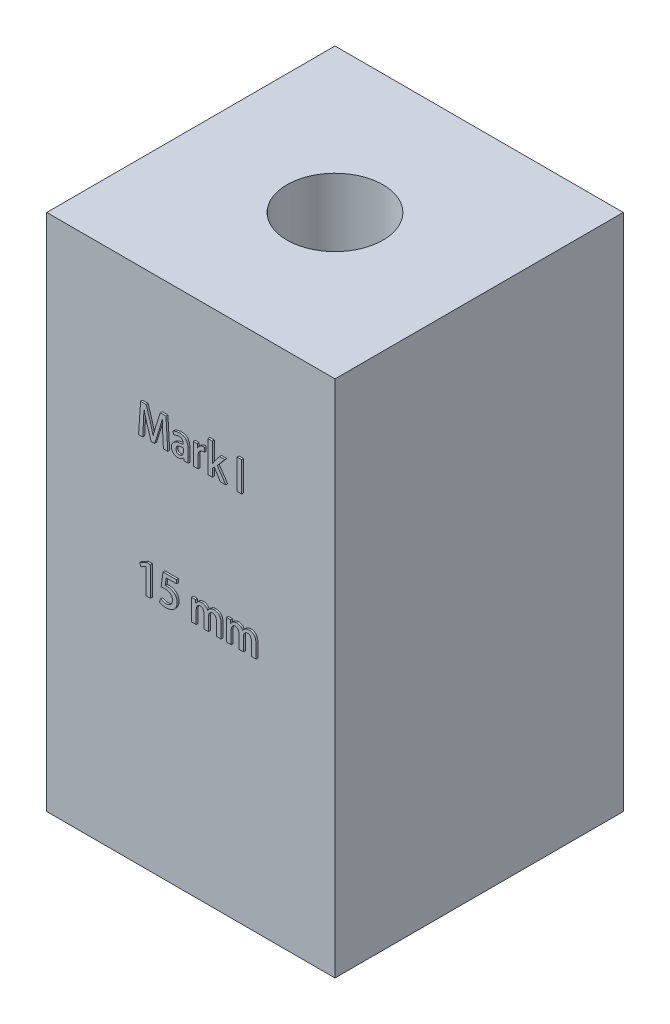
from build123d import *

# Parameters (mm, degrees)
CROQUIS1_W              = 15
CROQUIS1_H              = 15
CROQUIS1_R              = 2.5
SALIENTE_EXTRUIR1_DEPTH = 27
CROQUIS2_2_W            = 0.238171994
CROQUIS2_2_H            = 1.552222223
SALIENTE_EXTRUIR2_DEPTH = 0.1


with BuildPart() as part:
    # Croquis1 → Saliente-Extruir1 (new body)
    with BuildSketch(Plane(origin=(0, 0, 0), x_dir=(1, 0, 0), z_dir=(0, 1, 0))):
        Rectangle(CROQUIS1_W, CROQUIS1_H)
        Circle(CROQUIS1_R, mode=Mode.SUBTRACT)
    extrude(amount=SALIENTE_EXTRUIR1_DEPTH)

    # Croquis2<2> → Saliente-Extruir2 (add)
    # profile 1 of 9: a face of its own
    with BuildSketch(Plane.XY.offset(7.5)):
        with BuildLine():
            Line((-1.196299168, 21.029080524), (-1.489029741, 21.029080524))
            Line((-1.489029741, 21.029080524), (-1.713120041, 20.346907093))
            add(Edge.make_bspline(
                [(-1.713120041, 20.346907093), (-1.727697615, 20.299716085), (-1.756231951, 20.207343783), (-1.795341625, 20.070753521), (-1.829992127, 19.939079232), (-1.850660973, 19.852657221), (-1.860771731, 19.810381416)],
                knots=[0, 0, 0, 0, 1.06482216, 2.08429696, 3.06287894, 4, 4, 4, 4], degree=3))
            Line((-1.860771731, 19.810381416), (-1.866551238, 19.810381416))
            add(Edge.make_bspline(
                [(-1.866551238, 19.810381416), (-1.876481422, 19.853051166), (-1.896683618, 19.939859498), (-1.93070374, 20.071488595), (-1.967459767, 20.207101232), (-1.994351955, 20.298408277), (-2.008015817, 20.344801184)],
                knots=[0, 0, 0, 0, 0.950771496, 1.934271678, 2.950408035, 4, 4, 4, 4], degree=3))
            Line((-2.008015817, 20.344801184), (-2.225903251, 21.029080524))
            Line((-2.225903251, 21.029080524), (-2.516614993, 21.029080524))
            Line((-2.516614993, 21.029080524), (-2.621630897, 19.479409339))
            Line((-2.621630897, 19.479409339), (-2.403560427, 19.479409339))
            Line((-2.403560427, 19.479409339), (-2.36924029, 20.115225551))
            add(Edge.make_bspline(
                [(-2.36924029, 20.115225551), (-2.366142688, 20.170919846), (-2.35989255, 20.283296133), (-2.353809897, 20.423803434), (-2.348367501, 20.535729765), (-2.345730048, 20.61699773), (-2.342790327, 20.695298568), (-2.341738393, 20.746445045), (-2.341221555, 20.771574379)],
                knots=[0, 0, 0, 0, 1.528265809, 3.083634274, 3.853229214, 4.59840858, 5.311368824, 6, 6, 6, 6], degree=3))
            Line((-2.341221555, 20.771574379), (-2.334920154, 20.771597581))
            add(Edge.make_bspline(
                [(-2.334920154, 20.771597581), (-2.324589296, 20.723617077), (-2.303631025, 20.626278754), (-2.266531143, 20.479508668), (-2.225758304, 20.329473172), (-2.195122831, 20.22906041), (-2.179605039, 20.178198314)],
                knots=[0, 0, 0, 0, 0.959753872, 1.947058171, 2.960122984, 4, 4, 4, 4], degree=3))
            Line((-2.179605039, 20.178198314), (-1.967492815, 19.493601312))
            Line((-1.967492815, 19.493601312), (-1.791854471, 19.493601312))
            Line((-1.791854471, 19.493601312), (-1.561707676, 20.192452732))
            add(Edge.make_bspline(
                [(-1.561707676, 20.192452732), (-1.545557325, 20.241909213), (-1.513574545, 20.339848618), (-1.469197981, 20.486028271), (-1.427941936, 20.629553544), (-1.402746733, 20.724599981), (-1.390294614, 20.771574379)],
                knots=[0, 0, 0, 0, 1.033513873, 2.046682856, 3.034620343, 4, 4, 4, 4], degree=3))
            Line((-1.390294614, 20.771574379), (-1.384050501, 20.771597581))
            add(Edge.make_bspline(
                [(-1.384050501, 20.771597581), (-1.384147418, 20.746657815), (-1.384345026, 20.695806648), (-1.383338746, 20.618262138), (-1.381707988, 20.538078238), (-1.377545118, 20.428380993), (-1.371719332, 20.291107159), (-1.366485475, 20.18142271), (-1.363896272, 20.12716152)],
                knots=[0, 0, 0, 0, 0.69615936, 1.419440619, 2.164688967, 2.934803833, 4.483639269, 6, 6, 6, 6], degree=3))
            Line((-1.363896272, 20.12716152), (-1.32954205, 19.479409339))
            Line((-1.32954205, 19.479409339), (-1.103432918, 19.479409339))
            Line((-1.103432918, 19.479409339), (-1.196299168, 21.029080524))
        make_face()
    # profile 2 of 9: a face of its own
    with BuildSketch(Plane.XY.offset(7.5)):
        with BuildLine():
            add(Edge.make_bspline(
                [(-0.053952166, 20.155506797), (-0.053933683, 20.171094279), (-0.053897286, 20.201789221), (-0.057518774, 20.247008773), (-0.063893546, 20.290439821), (-0.073214651, 20.332080632), (-0.085936266, 20.371763587), (-0.101413142, 20.409687835), (-0.120056057, 20.445711117), (-0.141545368, 20.479861857), (-0.167086723, 20.511273005), (-0.197339407, 20.538867014), (-0.232386885, 20.562185402), (-0.272154981, 20.581216365), (-0.316470833, 20.596407), (-0.365308531, 20.607712644), (-0.418720262, 20.615108287), (-0.45586616, 20.61654487), (-0.475152092, 20.617290736)],
                knots=[0, 0, 0, 0, 1.04529413, 2.058397975, 3.039753549, 3.988049356, 4.917306062, 5.832005784, 6.732558164, 7.634995369, 8.534400609, 9.439717093, 10.371077683, 11.347885902, 12.389132223, 13.507522911, 14.705920534, 16, 16, 16, 16], degree=3))
            add(Edge.make_bspline(
                [(-0.475152092, 20.617290736), (-0.492957595, 20.616816764), (-0.528048962, 20.615882654), (-0.579600467, 20.61088989), (-0.629120436, 20.602765232), (-0.676037595, 20.591206125), (-0.720086934, 20.577835591), (-0.760725874, 20.56297161), (-0.797576215, 20.546416367), (-0.820085609, 20.533481991), (-0.830943079, 20.527243058)],
                knots=[0, 0, 0, 0, 1.151566781, 2.269526023, 3.346377101, 4.393757963, 5.391790339, 6.321988655, 7.190606464, 8, 8, 8, 8], degree=3))
            Line((-0.830943079, 20.527243058), (-0.781123083, 20.369063254))
            add(Edge.make_bspline(
                [(-0.781123083, 20.369063254), (-0.77171247, 20.37510656), (-0.75272953, 20.387297021), (-0.722239537, 20.403059962), (-0.690103274, 20.417263833), (-0.656139477, 20.428702506), (-0.621351216, 20.438541683), (-0.585956767, 20.445552861), (-0.550147937, 20.449783122), (-0.526200151, 20.450385225), (-0.514162975, 20.450687867)],
                knots=[0, 0, 0, 0, 0.947728913, 1.911743672, 2.906591377, 3.923705885, 4.947352295, 5.969890554, 6.979580645, 8, 8, 8, 8], degree=3))
            add(Edge.make_bspline(
                [(-0.514162975, 20.450687867), (-0.501813894, 20.449873349), (-0.478242904, 20.448318659), (-0.444972946, 20.442010936), (-0.415449317, 20.43362517), (-0.389446639, 20.42296027), (-0.367418177, 20.408938358), (-0.348994114, 20.39252782), (-0.334418974, 20.373321038), (-0.321472296, 20.344609444), (-0.310378364, 20.308152502), (-0.300596189, 20.265632707), (-0.296081909, 20.224913524), (-0.297364519, 20.198636491), (-0.297989886, 20.185824502)],
                knots=[0, 0, 0, 0, 1.124941475, 2.147203117, 3.073276344, 3.914150165, 4.693859246, 5.436944029, 6.148486199, 6.868538222, 8.288979618, 9.609682438, 10.834544209, 12, 12, 12, 12], degree=3))
            add(Edge.make_bspline(
                [(-0.297989886, 20.185824502), (-0.320678653, 20.185539999), (-0.365025123, 20.184983922), (-0.429782822, 20.180745531), (-0.490876774, 20.172779945), (-0.548357177, 20.161890924), (-0.60242818, 20.148446821), (-0.652727709, 20.130932907), (-0.699627981, 20.11078697), (-0.742785665, 20.087455124), (-0.78181461, 20.060849193), (-0.815831886, 20.03054531), (-0.844514985, 19.996643678), (-0.868702711, 19.959781778), (-0.887106432, 19.919009882), (-0.900985991, 19.875142448), (-0.90956491, 19.827714103), (-0.911105263, 19.794968866), (-0.911897994, 19.778116776)],
                knots=[0, 0, 0, 0, 1.312583045, 2.565517338, 3.751913568, 4.874585872, 5.948775456, 6.97196923, 7.952367169, 8.899011352, 9.80588498, 10.679130641, 11.525793372, 12.368308044, 13.221239438, 14.104974037, 15.024739096, 16, 16, 16, 16], degree=3))
            add(Edge.make_bspline(
                [(-0.911897994, 19.778116776), (-0.911473645, 19.767156476), (-0.910641021, 19.745651047), (-0.906633242, 19.713979761), (-0.899372869, 19.68374055), (-0.890222197, 19.654513549), (-0.877670348, 19.62680416), (-0.862708273, 19.600423672), (-0.845267409, 19.575176501), (-0.825103672, 19.551624148), (-0.802677089, 19.5297669), (-0.777493306, 19.511004679), (-0.750365313, 19.494799783), (-0.721140808, 19.481133874), (-0.689496917, 19.470690929), (-0.655746236, 19.462757034), (-0.61969828, 19.457773568), (-0.594937614, 19.456639732), (-0.582212035, 19.456057004)],
                knots=[0, 0, 0, 0, 1.019558823, 2.000497171, 2.961865832, 3.90763667, 4.843526869, 5.78386522, 6.724423229, 7.691661655, 8.662438953, 9.629634663, 10.603980382, 11.596308817, 12.622532153, 13.696327026, 14.81604254, 16, 16, 16, 16], degree=3))
            add(Edge.make_bspline(
                [(-0.582212035, 19.456057004), (-0.565841961, 19.456612545), (-0.533867175, 19.457697653), (-0.487707844, 19.466370755), (-0.444274735, 19.478668363), (-0.404395551, 19.496746116), (-0.368185088, 19.518848134), (-0.335215096, 19.543532898), (-0.306123182, 19.571455519), (-0.289918348, 19.592526447), (-0.281857566, 19.603007774)],
                knots=[0, 0, 0, 0, 1.130657597, 2.208452709, 3.237069398, 4.244418774, 5.223812689, 6.164576675, 7.087004055, 8, 8, 8, 8], degree=3))
            Line((-0.281857566, 19.603007774), (-0.275253111, 19.603065349))
            Line((-0.275253111, 19.603065349), (-0.258392086, 19.477618228))
            Line((-0.258392086, 19.477618228), (-0.037732768, 19.477618228))
            add(Edge.make_bspline(
                [(-0.037732768, 19.477618228), (-0.040897849, 19.496597162), (-0.047581659, 19.536675639), (-0.051747532, 19.600214154), (-0.05403103, 19.668395576), (-0.054172931, 19.715246615), (-0.054245195, 19.739105893)],
                knots=[0, 0, 0, 0, 0.879539962, 1.857355241, 2.908840502, 4, 4, 4, 4], degree=3))
            Line((-0.054245195, 19.739105893), (-0.053952166, 20.155506797))
        make_face()
        with BuildLine():
            add(Edge.make_bspline(
                [(-0.292123874, 19.85181673), (-0.292565708, 19.843563522), (-0.293425459, 19.827503836), (-0.297118337, 19.804055524), (-0.302157272, 19.781770952), (-0.30974875, 19.760760078), (-0.318698035, 19.74068664), (-0.329992125, 19.721921664), (-0.342912234, 19.704123049), (-0.357899957, 19.687847624), (-0.374138828, 19.672946445), (-0.391614279, 19.660011148), (-0.409781112, 19.64873434), (-0.42910308, 19.639619265), (-0.449388406, 19.632186668), (-0.470747733, 19.627011652), (-0.493045123, 19.623714024), (-0.508187646, 19.623016293), (-0.515922865, 19.622659873)],
                knots=[0, 0, 0, 0, 1.1127689, 2.165305488, 3.194083487, 4.185588777, 5.169981375, 6.15040018, 7.13046498, 8.12816315, 9.12586132, 10.095335325, 11.053196287, 12.001774197, 12.968470205, 13.958837393, 14.957317833, 16, 16, 16, 16], degree=3))
            add(Edge.make_bspline(
                [(-0.515922865, 19.622659873), (-0.526348867, 19.622986841), (-0.54677129, 19.623627305), (-0.576043385, 19.632361798), (-0.60296697, 19.646059855), (-0.627344866, 19.665200397), (-0.647756744, 19.69069521), (-0.66238159, 19.722675436), (-0.671428419, 19.760622731), (-0.672737046, 19.787936502), (-0.673432972, 19.802461914)],
                knots=[0, 0, 0, 0, 0.925162071, 1.812204857, 2.691873356, 3.602553412, 4.549923018, 5.56994314, 6.707700436, 8, 8, 8, 8], degree=3))
            add(Edge.make_bspline(
                [(-0.673432972, 19.802461914), (-0.672504166, 19.814124606), (-0.670710258, 19.836650073), (-0.664133484, 19.868903199), (-0.653394707, 19.897940713), (-0.639623735, 19.923993766), (-0.622452724, 19.947140376), (-0.60120143, 19.966485377), (-0.576944474, 19.983265842), (-0.53961783, 20.000360001), (-0.489300298, 20.016507544), (-0.426242327, 20.030369907), (-0.360162716, 20.037877182), (-0.315313119, 20.037760195), (-0.292416903, 20.037700472)],
                knots=[0, 0, 0, 0, 0.831751151, 1.606454387, 2.332498033, 3.02628555, 3.696675427, 4.370806108, 5.061344671, 5.786088267, 7.281491765, 8.811961156, 10.372470837, 12, 12, 12, 12], degree=3))
            Line((-0.292416903, 20.037700472), (-0.292123874, 19.85181673))
        make_face(mode=Mode.SUBTRACT)
    # profile 3 of 9: a face of its own
    with BuildSketch(Plane.XY.offset(7.5)):
        with BuildLine():
            add(Edge.make_bspline(
                [(0.798083824, 20.611553336), (0.788539911, 20.613210649), (0.769047446, 20.61659554), (0.749267113, 20.617055819), (0.739171639, 20.617290736)],
                knots=[0, 0, 0, 0, 0.97924127, 2, 2, 2, 2], degree=3))
            add(Edge.make_bspline(
                [(0.739171639, 20.617290736), (0.723847826, 20.616453707), (0.693455305, 20.614793584), (0.648964014, 20.602845287), (0.606665471, 20.583392189), (0.566554279, 20.557213359), (0.529366688, 20.524773207), (0.497456952, 20.485421616), (0.469512451, 20.440761818), (0.456024619, 20.407616391), (0.449083192, 20.39055831)],
                knots=[0, 0, 0, 0, 0.938175605, 1.860732817, 2.801619752, 3.780189859, 4.786007179, 5.811395864, 6.873648904, 8, 8, 8, 8], degree=3))
            Line((0.449083192, 20.39055831), (0.440870375, 20.390609296))
            Line((0.440870375, 20.390609296), (0.432657557, 20.593479237))
            Line((0.432657557, 20.593479237), (0.225386747, 20.593479237))
            add(Edge.make_bspline(
                [(0.225386747, 20.593479237), (0.226735788, 20.567494093), (0.229489608, 20.514450168), (0.231570538, 20.432608946), (0.233218682, 20.345688049), (0.233208637, 20.28584588), (0.233203418, 20.254753506)],
                knots=[0, 0, 0, 0, 0.921405029, 1.880880017, 2.898962507, 4, 4, 4, 4], degree=3))
            Line((0.233203418, 20.254753506), (0.233496446, 19.478268161))
            Line((0.233496446, 19.478268161), (0.47166844, 19.478268161))
            Line((0.47166844, 19.478268161), (0.47166844, 20.070276186))
            add(Edge.make_bspline(
                [(0.47166844, 20.070276186), (0.472033638, 20.082301823), (0.47274468, 20.105715785), (0.475848675, 20.139945871), (0.481442585, 20.172189381), (0.489050183, 20.202603479), (0.498765514, 20.231145838), (0.510353047, 20.258001793), (0.524589729, 20.282599339), (0.540410607, 20.305428882), (0.558265096, 20.325823855), (0.577615533, 20.344024212), (0.599106245, 20.358987052), (0.621896445, 20.371773551), (0.646567142, 20.381305855), (0.672514788, 20.388861822), (0.700215782, 20.393190292), (0.719212277, 20.393972346), (0.728905617, 20.394371404)],
                knots=[0, 0, 0, 0, 1.241840886, 2.417868999, 3.544527356, 4.616704577, 5.650820151, 6.654086497, 7.630544836, 8.5797601, 9.516878827, 10.423948895, 11.314471818, 12.213419717, 13.114913654, 14.038234368, 14.998969914, 16, 16, 16, 16], degree=3))
            add(Edge.make_bspline(
                [(0.728905617, 20.394371404), (0.741154195, 20.394190832), (0.764272582, 20.393850016), (0.787101102, 20.390214468), (0.797834621, 20.388505106)],
                knots=[0, 0, 0, 0, 1.059639438, 2, 2, 2, 2], degree=3))
            Line((0.797834621, 20.388505106), (0.798083824, 20.611553336))
        make_face()
    # profile 4 of 9: a face of its own
    with BuildSketch(Plane.XY.offset(7.5)):
        with BuildLine():
            Line((1.473955281, 20.134031505), (1.867275682, 20.594647054))
            Line((1.867275682, 20.594647054), (1.589518491, 20.594647054))
            Line((1.589518491, 20.594647054), (1.311761301, 20.221284671))
            add(Edge.make_bspline(
                [(1.311761301, 20.221284671), (1.297091766, 20.200201073), (1.267485244, 20.157649487), (1.240155846, 20.113600536), (1.226367706, 20.091377101)],
                knots=[0, 0, 0, 0, 0.99096644, 2, 2, 2, 2], degree=3))
            Line((1.226367706, 20.091377101), (1.222554612, 20.091419494))
            Line((1.222554612, 20.091419494), (1.222554612, 21.103899887))
            Line((1.222554612, 21.103899887), (0.984382618, 21.103899887))
            Line((0.984382618, 21.103899887), (0.984382618, 19.476589047))
            Line((0.984382618, 19.476589047), (1.222554612, 19.476589047))
            Line((1.222554612, 19.476589047), (1.222554612, 19.878359438))
            Line((1.222554612, 19.878359438), (1.313788726, 19.989962325))
            Line((1.313788726, 19.989962325), (1.634121836, 19.476589047))
            Line((1.634121836, 19.476589047), (1.9179613, 19.476589047))
            Line((1.9179613, 19.476589047), (1.473955281, 20.134031505))
        make_face()
    # profile 5 of 9: a face of its own
    with BuildSketch(Plane.XY.offset(7.5)):
        with Locations((2.624013114, 20.252700159)):
            Rectangle(CROQUIS2_2_W, CROQUIS2_2_H)
    # profile 6 of 9: a face of its own
    with BuildSketch(Plane.XY.offset(7.5)):
        Polygon((-2.006255927, 12.406347497), (-2.006255927, 13.92454519), (-2.212803475, 13.92454519), (-2.558678757, 13.749288098), (-2.505965713, 13.578477993), (-2.248482771, 13.720397725), (-2.244427921, 13.720397725), (-2.244427921, 12.408653915), align=None)
    # profile 7 of 9: a face of its own
    with BuildSketch(Plane.XY.offset(7.5)):
        with BuildLine():
            Line((-1.350512347, 13.924105217), (-1.44580131, 13.20128046))
            add(Edge.make_bspline(
                [(-1.44580131, 13.20128046), (-1.43298494, 13.203147672), (-1.405695444, 13.20712347), (-1.362099157, 13.21075672), (-1.313463585, 13.21265508), (-1.279423347, 13.213049488), (-1.261529368, 13.213256817)],
                knots=[0, 0, 0, 0, 0.840675257, 1.790023498, 2.838278579, 4, 4, 4, 4], degree=3))
            add(Edge.make_bspline(
                [(-1.261529368, 13.213256817), (-1.245097713, 13.21283534), (-1.213259176, 13.212018673), (-1.16705693, 13.208125916), (-1.124104076, 13.200873708), (-1.084108271, 13.191919652), (-1.047556468, 13.179267997), (-1.013846245, 13.164982757), (-0.9837878, 13.147029866), (-0.956592106, 13.127173619), (-0.932738292, 13.104740922), (-0.91202921, 13.080260266), (-0.894571806, 13.053673619), (-0.880494434, 13.024941725), (-0.869232078, 12.994301358), (-0.861433211, 12.961618437), (-0.856576099, 12.926932733), (-0.856113047, 12.903142022), (-0.855874846, 12.89090373)],
                knots=[0, 0, 0, 0, 1.341376774, 2.59909746, 3.779710086, 4.894529723, 5.939178048, 6.932464489, 7.876722667, 8.789576717, 9.675853731, 10.542223295, 11.400915923, 12.264488366, 13.147995251, 14.059523137, 15.001790096, 16, 16, 16, 16], degree=3))
            add(Edge.make_bspline(
                [(-0.855874846, 12.89090373), (-0.856548815, 12.878662862), (-0.857864707, 12.854763128), (-0.863250285, 12.820031096), (-0.871046155, 12.787271137), (-0.881871196, 12.756645866), (-0.895763471, 12.728208392), (-0.912612399, 12.702022857), (-0.931986345, 12.677842007), (-0.954089594, 12.656046668), (-0.978406121, 12.637066697), (-1.003673338, 12.619719854), (-1.030463122, 12.605373146), (-1.058501293, 12.593659531), (-1.087689017, 12.584107688), (-1.118159443, 12.577506237), (-1.149851103, 12.573215351), (-1.171369689, 12.572651197), (-1.182334342, 12.572363737)],
                knots=[0, 0, 0, 0, 1.152868708, 2.250923491, 3.301801517, 4.317254504, 5.300529871, 6.272770222, 7.241085836, 8.210318644, 9.185817546, 10.140047819, 11.09081316, 12.039038429, 12.996146563, 13.975973343, 14.968670553, 16, 16, 16, 16], degree=3))
            add(Edge.make_bspline(
                [(-1.182334342, 12.572363737), (-1.19770527, 12.57277607), (-1.22775537, 12.57358218), (-1.271670161, 12.579364921), (-1.313775575, 12.586492304), (-1.353263448, 12.59764633), (-1.389787296, 12.609822368), (-1.422902199, 12.622459695), (-1.452209263, 12.635369757), (-1.469941843, 12.645180615), (-1.478289087, 12.649798873)],
                knots=[0, 0, 0, 0, 1.193399157, 2.333090457, 3.436795921, 4.50708013, 5.515645667, 6.426671089, 7.259387983, 8, 8, 8, 8], degree=3))
            Line((-1.478289087, 12.649798873), (-1.53095315, 12.47224052))
            add(Edge.make_bspline(
                [(-1.53095315, 12.47224052), (-1.521128296, 12.466500875), (-1.500408129, 12.454396227), (-1.465390911, 12.439466883), (-1.425703754, 12.42542339), (-1.381549105, 12.412733086), (-1.33374426, 12.401715492), (-1.282811559, 12.394428257), (-1.229466621, 12.389213062), (-1.193004546, 12.388322632), (-1.17441484, 12.387868658)],
                knots=[0, 0, 0, 0, 0.736688515, 1.55364239, 2.461382292, 3.463906092, 4.529034637, 5.637376459, 6.795447667, 8, 8, 8, 8], degree=3))
            add(Edge.make_bspline(
                [(-1.17441484, 12.387868658), (-1.153855568, 12.388702437), (-1.113570597, 12.39033619), (-1.054938297, 12.398468483), (-0.999302556, 12.410296592), (-0.947030924, 12.427009359), (-0.897932776, 12.448291429), (-0.852106272, 12.473787805), (-0.809395189, 12.503706071), (-0.770285307, 12.537857442), (-0.735272128, 12.575717244), (-0.704112777, 12.615977268), (-0.678031428, 12.659096375), (-0.656070631, 12.704481679), (-0.63903494, 12.752592524), (-0.626789725, 12.80321266), (-0.619035705, 12.856356115), (-0.617570503, 12.892637556), (-0.616823194, 12.911142459)],
                knots=[0, 0, 0, 0, 1.153861066, 2.260939018, 3.31647699, 4.341761202, 5.334341534, 6.314182747, 7.279045245, 8.254885833, 9.221368745, 10.168239568, 11.10621774, 12.043473791, 12.992550795, 13.963801276, 14.961461872, 16, 16, 16, 16], degree=3))
            add(Edge.make_bspline(
                [(-0.616823194, 12.911142459), (-0.617752851, 12.930140733), (-0.619562946, 12.967131471), (-0.627877719, 13.020653409), (-0.640348932, 13.070527486), (-0.65748124, 13.116647711), (-0.678801889, 13.159286688), (-0.705283934, 13.197837718), (-0.735551204, 13.233231487), (-0.770648936, 13.264092192), (-0.808840834, 13.29117334), (-0.849066366, 13.315141407), (-0.891501089, 13.334995459), (-0.935884299, 13.351652729), (-0.982421066, 13.364456427), (-1.031079968, 13.373551056), (-1.081705119, 13.378875482), (-1.116130254, 13.379527813), (-1.133644067, 13.379859686)],
                knots=[0, 0, 0, 0, 1.161144111, 2.26081465, 3.302219781, 4.296139684, 5.260280275, 6.206065629, 7.14595017, 8.097655962, 9.052205465, 10.002655077, 10.953667363, 11.909840711, 12.895057104, 13.897658319, 14.930432064, 16, 16, 16, 16], degree=3))
            add(Edge.make_bspline(
                [(-1.133644067, 13.379859686), (-1.143226953, 13.379598011), (-1.16161501, 13.379095897), (-1.188109942, 13.377867911), (-1.212384324, 13.37658348), (-1.227802542, 13.375026674), (-1.235131026, 13.374286703)],
                knots=[0, 0, 0, 0, 1.131480046, 2.171133133, 3.130715184, 4, 4, 4, 4], degree=3))
            Line((-1.235131026, 13.374286703), (-1.184263518, 13.739609565))
            Line((-1.184263518, 13.739609565), (-0.649023385, 13.739609565))
            Line((-0.649023385, 13.739609565), (-0.649023385, 13.924105217))
            Line((-0.649023385, 13.924105217), (-1.350512347, 13.924105217))
        make_face()
    # profile 8 of 9: a face of its own
    with BuildSketch(Plane.XY.offset(7.5)):
        with BuildLine():
            add(Edge.make_bspline(
                [(1.673086029, 13.090464425), (1.67215772, 13.111077003), (1.670365963, 13.150861952), (1.663815589, 13.208116919), (1.654840245, 13.260791645), (1.641836074, 13.308435454), (1.626213175, 13.351330131), (1.607054541, 13.389270084), (1.584725268, 13.42252538), (1.55905493, 13.450782133), (1.531172757, 13.474285603), (1.502990684, 13.495127157), (1.473861975, 13.512414251), (1.444116532, 13.526724485), (1.413415931, 13.53741003), (1.381877872, 13.544208935), (1.34978937, 13.548726162), (1.328163308, 13.548586131), (1.317295329, 13.54851576)],
                knots=[0, 0, 0, 0, 1.513261231, 2.920790482, 4.225039661, 5.429095985, 6.538902965, 7.568588871, 8.539409605, 9.468669045, 10.358677973, 11.210859535, 12.037483604, 12.839564471, 13.628941055, 14.4154775, 15.203712731, 16, 16, 16, 16], degree=3))
            add(Edge.make_bspline(
                [(1.317295329, 13.54851576), (1.298079599, 13.547757116), (1.260829637, 13.546286475), (1.207305651, 13.535705198), (1.157840201, 13.519457225), (1.112968522, 13.495943442), (1.072406348, 13.466676206), (1.034744112, 13.433531571), (1.00106113, 13.395010462), (0.981834694, 13.366489389), (0.972063678, 13.35199477)],
                knots=[0, 0, 0, 0, 1.108126197, 2.148118191, 3.136426768, 4.10280475, 5.057637098, 6.016626622, 6.992035069, 8, 8, 8, 8], degree=3))
            Line((0.972063678, 13.35199477), (0.968006824, 13.352002217))
            add(Edge.make_bspline(
                [(0.968006824, 13.352002217), (0.961392471, 13.366707133), (0.948448558, 13.39548382), (0.921685547, 13.434177719), (0.890103124, 13.46783246), (0.853781486, 13.49650351), (0.813254282, 13.519473905), (0.768881432, 13.535897487), (0.721292811, 13.546591562), (0.688291365, 13.547864722), (0.671415895, 13.54851576)],
                knots=[0, 0, 0, 0, 1.020955632, 1.99795227, 2.96752067, 3.938931661, 4.92195175, 5.909051468, 6.930781959, 8, 8, 8, 8], degree=3))
            add(Edge.make_bspline(
                [(0.671415895, 13.54851576), (0.6521002, 13.547449292), (0.61511286, 13.545407129), (0.562388939, 13.534511912), (0.515249124, 13.517070985), (0.474221835, 13.492789433), (0.438592589, 13.464778075), (0.407276231, 13.434690478), (0.380074943, 13.402786337), (0.365787507, 13.379377136), (0.3587422, 13.367833775)],
                knots=[0, 0, 0, 0, 1.224631561, 2.345029053, 3.39800305, 4.394808606, 5.352867572, 6.264332918, 7.144121535, 8, 8, 8, 8], degree=3))
            Line((0.3587422, 13.367833775), (0.352736119, 13.368050897))
            Line((0.352736119, 13.368050897), (0.340200343, 13.525358204))
            Line((0.340200343, 13.525358204), (0.131525976, 13.525358204))
            add(Edge.make_bspline(
                [(0.131525976, 13.525358204), (0.132493307, 13.502377927), (0.134468753, 13.455448483), (0.136595679, 13.39589831), (0.138368214, 13.345843903), (0.138685915, 13.305454338), (0.139522755, 13.262536495), (0.139403866, 13.233104947), (0.139342646, 13.217949856)],
                knots=[0, 0, 0, 0, 1.346187736, 2.749133221, 3.487683855, 4.277464658, 5.113020504, 6, 6, 6, 6], degree=3))
            Line((0.139342646, 13.217949856), (0.139635675, 12.415331985))
            Line((0.139635675, 12.415331985), (0.377807669, 12.415331985))
            Line((0.377807669, 12.415331985), (0.377807669, 13.09249185))
            add(Edge.make_bspline(
                [(0.377807669, 13.09249185), (0.378348178, 13.103232166), (0.379399057, 13.124113934), (0.383309839, 13.154351077), (0.388603781, 13.182714145), (0.396741567, 13.208921168), (0.4063118, 13.233312822), (0.417749669, 13.255813951), (0.431292194, 13.276229203), (0.446897459, 13.294305112), (0.463581554, 13.3102841), (0.480601331, 13.324459513), (0.498012247, 13.336630126), (0.515924601, 13.346708092), (0.534444651, 13.354404904), (0.553412463, 13.359518265), (0.572608886, 13.363404703), (0.585650228, 13.363814309), (0.592220869, 13.364020681)],
                knots=[0, 0, 0, 0, 1.345028047, 2.615059288, 3.812240957, 4.950008049, 6.042686379, 7.08768926, 8.102172383, 9.099996684, 10.068982838, 10.989984122, 11.868914175, 12.723236376, 13.556990843, 14.370301474, 15.178906315, 16, 16, 16, 16], degree=3))
            add(Edge.make_bspline(
                [(0.592220869, 13.364020681), (0.600061394, 13.363617765), (0.615262384, 13.362836603), (0.637138995, 13.358672907), (0.657348023, 13.35218983), (0.676014706, 13.343336594), (0.693028444, 13.332125134), (0.70865157, 13.318820156), (0.722008049, 13.302722765), (0.73839249, 13.2784282), (0.754230828, 13.243127456), (0.768611103, 13.196390913), (0.776167652, 13.143983411), (0.777106302, 13.107390927), (0.777595893, 13.088304665)],
                knots=[0, 0, 0, 0, 0.755950668, 1.465615932, 2.139074498, 2.796588983, 3.449971736, 4.097964407, 4.76639413, 5.458962618, 6.917416126, 8.473425038, 10.160574856, 12, 12, 12, 12], degree=3))
            Line((0.777595893, 13.088304665), (0.777888921, 12.415331985))
            Line((0.777888921, 12.415331985), (1.016060629, 12.415331985))
            Line((1.016060629, 12.415331985), (1.016060629, 13.104656398))
            add(Edge.make_bspline(
                [(1.016060629, 13.104656398), (1.016353399, 13.114571964), (1.016923084, 13.133866112), (1.021025984, 13.161890797), (1.026417888, 13.188429555), (1.034052204, 13.213245523), (1.043384886, 13.236423752), (1.055028985, 13.257615396), (1.06812976, 13.277456637), (1.08339485, 13.295181398), (1.099920174, 13.311035697), (1.117023788, 13.325066276), (1.13481524, 13.336940192), (1.153152668, 13.346742493), (1.172119183, 13.354409104), (1.191853198, 13.359596926), (1.211950274, 13.363375547), (1.225665744, 13.363805556), (1.232527319, 13.364020681)],
                knots=[0, 0, 0, 0, 1.267233675, 2.465839704, 3.615673463, 4.726804397, 5.780700789, 6.804285049, 7.813184962, 8.815168933, 9.787633234, 10.738404153, 11.639821434, 12.517791614, 13.392909498, 14.248069017, 15.123543946, 16, 16, 16, 16], degree=3))
            add(Edge.make_bspline(
                [(1.232527319, 13.364020681), (1.24104506, 13.363598871), (1.257591622, 13.362779462), (1.281637079, 13.358845879), (1.303617687, 13.351507281), (1.324280038, 13.342725949), (1.342511559, 13.330226053), (1.359492705, 13.315984048), (1.374201521, 13.298535998), (1.387325849, 13.278934345), (1.398746755, 13.257167011), (1.408343734, 13.233402408), (1.416920116, 13.207997405), (1.423645135, 13.180618265), (1.428409127, 13.151460102), (1.4324143, 13.120568649), (1.434335708, 13.087743085), (1.434524513, 13.065232341), (1.434621293, 13.053693505)],
                knots=[0, 0, 0, 0, 0.979325905, 1.902438322, 2.786756391, 3.636233264, 4.470958944, 5.315074409, 6.175027208, 7.081388835, 8.020752095, 8.99258041, 10.022434341, 11.098284182, 12.226320848, 13.414468146, 14.674676153, 16, 16, 16, 16], degree=3))
            Line((1.434621293, 13.053693505), (1.434914035, 12.415331985))
            Line((1.434914035, 12.415331985), (1.673086029, 12.415331985))
            Line((1.673086029, 12.415331985), (1.673086029, 13.090464425))
        make_face()
    # profile 9 of 9: a face of its own
    with BuildSketch(Plane.XY.offset(7.5)):
        with BuildLine():
            add(Edge.make_bspline(
                [(3.493984996, 13.090464425), (3.493056687, 13.111077003), (3.49126493, 13.150861952), (3.484714556, 13.208116919), (3.475739212, 13.260791645), (3.462735041, 13.308435454), (3.447112142, 13.351330131), (3.427953508, 13.389270084), (3.405624235, 13.42252538), (3.379953897, 13.450782133), (3.352071724, 13.474285603), (3.323889651, 13.495127157), (3.294760942, 13.512414251), (3.2650155, 13.526724485), (3.234314898, 13.53741003), (3.202776839, 13.544208935), (3.170688337, 13.548726162), (3.149062275, 13.548586131), (3.138194296, 13.54851576)],
                knots=[0, 0, 0, 0, 1.513261231, 2.920790482, 4.225039661, 5.429095985, 6.538902965, 7.568588871, 8.539409605, 9.468669045, 10.358677973, 11.210859535, 12.037483604, 12.839564471, 13.628941055, 14.4154775, 15.203712731, 16, 16, 16, 16], degree=3))
            add(Edge.make_bspline(
                [(3.138194296, 13.54851576), (3.118978566, 13.547757116), (3.081728604, 13.546286475), (3.028204618, 13.535705198), (2.978739168, 13.519457225), (2.933867489, 13.495943442), (2.893305315, 13.466676206), (2.855643079, 13.433531571), (2.821960097, 13.395010462), (2.802733661, 13.366489389), (2.792962646, 13.35199477)],
                knots=[0, 0, 0, 0, 1.108126197, 2.148118191, 3.136426768, 4.10280475, 5.057637098, 6.016626622, 6.992035069, 8, 8, 8, 8], degree=3))
            Line((2.792962646, 13.35199477), (2.788905791, 13.352002217))
            add(Edge.make_bspline(
                [(2.788905791, 13.352002217), (2.782291438, 13.366707133), (2.769347526, 13.39548382), (2.742584514, 13.434177719), (2.711002091, 13.46783246), (2.674680453, 13.49650351), (2.634153249, 13.519473905), (2.589780399, 13.535897487), (2.542191778, 13.546591562), (2.509190332, 13.547864722), (2.492314862, 13.54851576)],
                knots=[0, 0, 0, 0, 1.020955632, 1.99795227, 2.96752067, 3.938931661, 4.92195175, 5.909051468, 6.930781959, 8, 8, 8, 8], degree=3))
            add(Edge.make_bspline(
                [(2.492314862, 13.54851576), (2.472999167, 13.547449292), (2.436011827, 13.545407129), (2.383287906, 13.534511912), (2.336148092, 13.517070985), (2.295120802, 13.492789433), (2.259491556, 13.464778075), (2.228175198, 13.434690478), (2.20097391, 13.402786337), (2.186686475, 13.379377136), (2.179641167, 13.367833775)],
                knots=[0, 0, 0, 0, 1.224631561, 2.345029053, 3.39800305, 4.394808606, 5.352867572, 6.264332918, 7.144121535, 8, 8, 8, 8], degree=3))
            Line((2.179641167, 13.367833775), (2.173635086, 13.368050897))
            Line((2.173635086, 13.368050897), (2.161099311, 13.525358204))
            Line((2.161099311, 13.525358204), (1.952424943, 13.525358204))
            add(Edge.make_bspline(
                [(1.952424943, 13.525358204), (1.953392274, 13.502377927), (1.95536772, 13.455448483), (1.957494646, 13.39589831), (1.959267181, 13.345843903), (1.959584882, 13.305454338), (1.960421722, 13.262536495), (1.960302833, 13.233104947), (1.960241613, 13.217949856)],
                knots=[0, 0, 0, 0, 1.346187736, 2.749133221, 3.487683855, 4.277464658, 5.113020504, 6, 6, 6, 6], degree=3))
            Line((1.960241613, 13.217949856), (1.960534642, 12.415331985))
            Line((1.960534642, 12.415331985), (2.198706636, 12.415331985))
            Line((2.198706636, 12.415331985), (2.198706636, 13.09249185))
            add(Edge.make_bspline(
                [(2.198706636, 13.09249185), (2.199247145, 13.103232166), (2.200298025, 13.124113934), (2.204208806, 13.154351077), (2.209502748, 13.182714145), (2.217640534, 13.208921168), (2.227210767, 13.233312822), (2.238648636, 13.255813951), (2.252191161, 13.276229203), (2.267796426, 13.294305112), (2.284480521, 13.3102841), (2.301500299, 13.324459513), (2.318911214, 13.336630126), (2.336823568, 13.346708092), (2.355343618, 13.354404904), (2.37431143, 13.359518265), (2.393507853, 13.363404703), (2.406549195, 13.363814309), (2.413119836, 13.364020681)],
                knots=[0, 0, 0, 0, 1.345028047, 2.615059288, 3.812240957, 4.950008049, 6.042686379, 7.08768926, 8.102172383, 9.099996684, 10.068982838, 10.989984122, 11.868914175, 12.723236376, 13.556990843, 14.370301474, 15.178906315, 16, 16, 16, 16], degree=3))
            add(Edge.make_bspline(
                [(2.413119836, 13.364020681), (2.420960361, 13.363617765), (2.436161351, 13.362836603), (2.458037962, 13.358672907), (2.47824699, 13.35218983), (2.496913673, 13.343336594), (2.513927411, 13.332125134), (2.529550537, 13.318820156), (2.542907016, 13.302722765), (2.559291457, 13.2784282), (2.575129795, 13.243127456), (2.58951007, 13.196390913), (2.597066619, 13.143983411), (2.598005269, 13.107390927), (2.59849486, 13.088304665)],
                knots=[0, 0, 0, 0, 0.755950668, 1.465615932, 2.139074498, 2.796588983, 3.449971736, 4.097964407, 4.76639413, 5.458962618, 6.917416126, 8.473425038, 10.160574856, 12, 12, 12, 12], degree=3))
            Line((2.59849486, 13.088304665), (2.598787888, 12.415331985))
            Line((2.598787888, 12.415331985), (2.836959596, 12.415331985))
            Line((2.836959596, 12.415331985), (2.836959596, 13.104656398))
            add(Edge.make_bspline(
                [(2.836959596, 13.104656398), (2.837252366, 13.114571964), (2.837822051, 13.133866112), (2.841924951, 13.161890797), (2.847316855, 13.188429555), (2.854951171, 13.213245523), (2.864283853, 13.236423752), (2.875927952, 13.257615396), (2.889028727, 13.277456637), (2.904293817, 13.295181398), (2.920819141, 13.311035697), (2.937922755, 13.325066276), (2.955714207, 13.336940192), (2.974051635, 13.346742493), (2.99301815, 13.354409104), (3.012752165, 13.359596926), (3.032849241, 13.363375547), (3.046564711, 13.363805556), (3.053426286, 13.364020681)],
                knots=[0, 0, 0, 0, 1.267233675, 2.465839704, 3.615673463, 4.726804397, 5.780700789, 6.804285049, 7.813184962, 8.815168933, 9.787633234, 10.738404153, 11.639821434, 12.517791614, 13.392909498, 14.248069017, 15.123543946, 16, 16, 16, 16], degree=3))
            add(Edge.make_bspline(
                [(3.053426286, 13.364020681), (3.061944027, 13.363598871), (3.078490589, 13.362779462), (3.102536046, 13.358845879), (3.124516654, 13.351507281), (3.145179005, 13.342725949), (3.163410526, 13.330226053), (3.180391672, 13.315984048), (3.195100488, 13.298535998), (3.208224816, 13.278934345), (3.219645722, 13.257167011), (3.229242701, 13.233402408), (3.237819083, 13.207997405), (3.244544102, 13.180618265), (3.249308094, 13.151460102), (3.253313267, 13.120568649), (3.255234675, 13.087743085), (3.25542348, 13.065232341), (3.25552026, 13.053693505)],
                knots=[0, 0, 0, 0, 0.979325905, 1.902438322, 2.786756391, 3.636233264, 4.470958944, 5.315074409, 6.175027208, 7.081388835, 8.020752095, 8.99258041, 10.022434341, 11.098284182, 12.226320848, 13.414468146, 14.674676153, 16, 16, 16, 16], degree=3))
            Line((3.25552026, 13.053693505), (3.255813002, 12.415331985))
            Line((3.255813002, 12.415331985), (3.493984996, 12.415331985))
            Line((3.493984996, 12.415331985), (3.493984996, 13.090464425))
        make_face()
    extrude(amount=SALIENTE_EXTRUIR2_DEPTH)


solid = part.part
